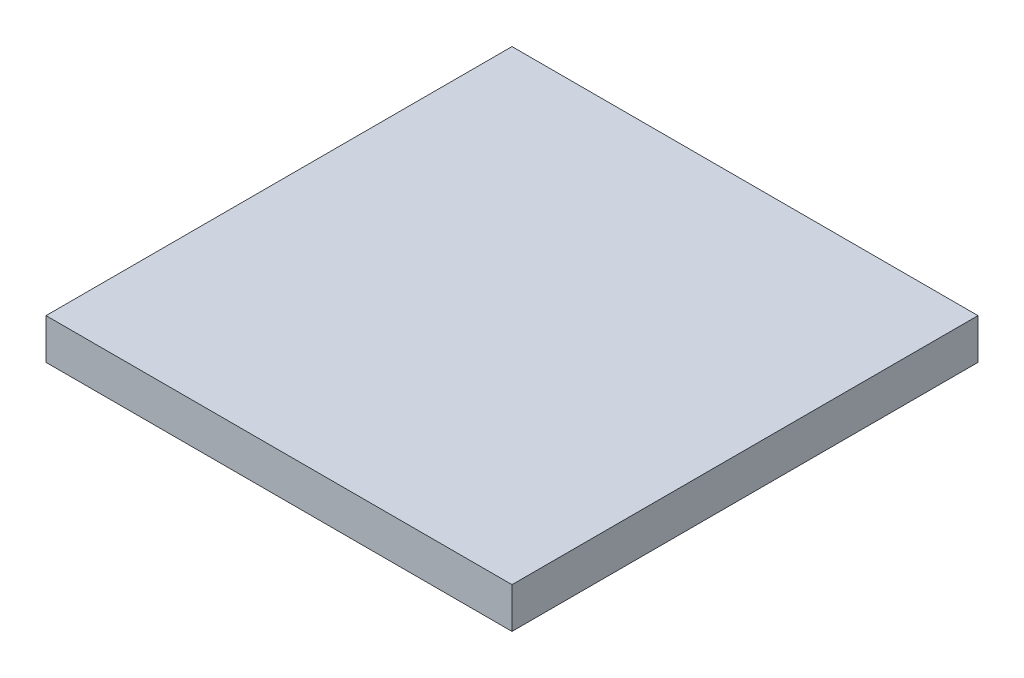
from build123d import *

# Parameters (mm, degrees)
SKETCH1_W           = 115
SKETCH1_H           = 115
BOSS_EXTRUDE1_DEPTH = 10


with BuildPart() as part:
    # Sketch1 → Boss-Extrude1 (new body)
    with BuildSketch(Plane(origin=(0, 0, 0), x_dir=(1, 0, 0), z_dir=(0, 1, 0))):
        Rectangle(SKETCH1_W, SKETCH1_H)
    extrude(amount=BOSS_EXTRUDE1_DEPTH)


solid = part.part
